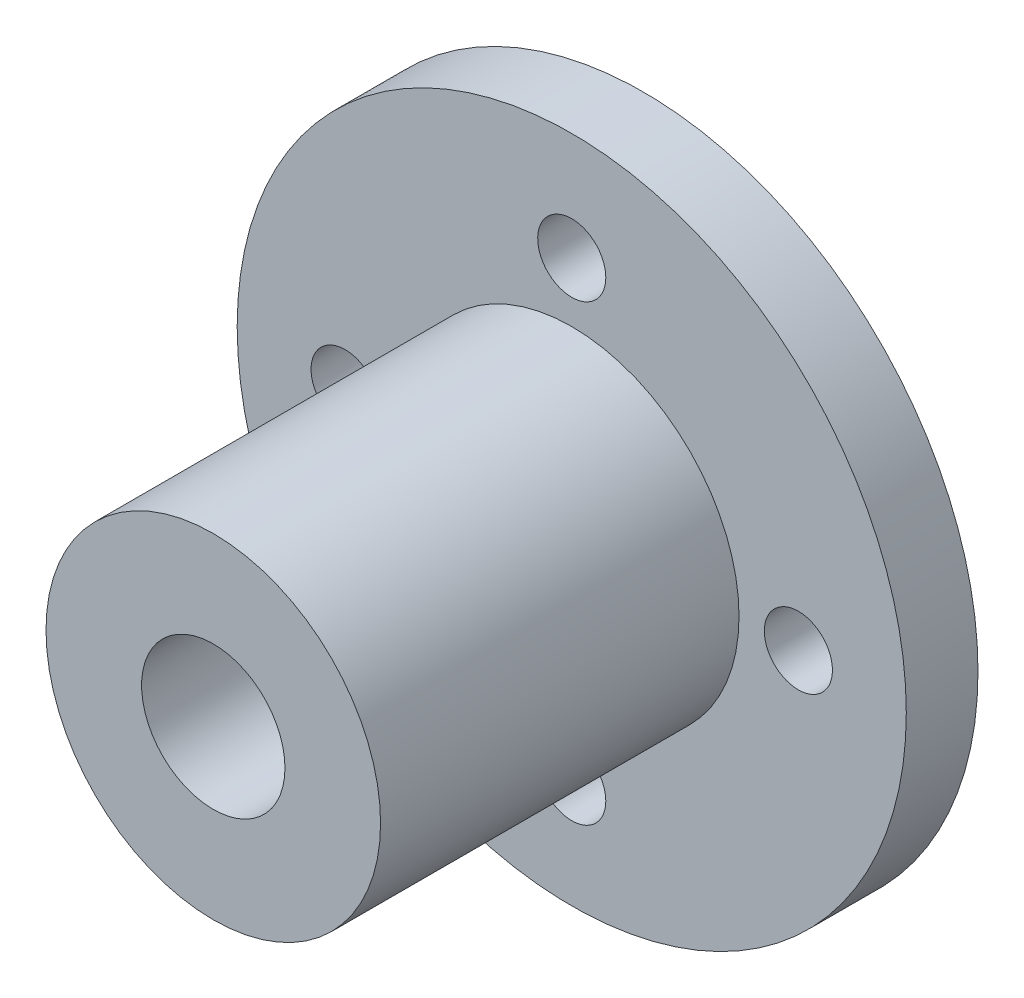
from build123d import *

# Parameters (mm, degrees)
IZIM1_R                     = 14
Y_KSEKLIK_EKSTR_ZYON1_DEPTH = 3
IZIM2_R                     = 7
Y_KSEKLIK_EKSTR_ZYON2_DEPTH = 15
IZIM3_R                     = 3
KES_EKSTR_ZYON1_DEPTH       = 18
IZIM4_R                     = 1.425
KES_EKSTR_ZYON2_DEPTH       = 18
DAIRESEL_KAPLAMA1_COUNT     = 4


with BuildPart() as part:
    # Çizim1 → Yükseklik-Ekstrüzyon1 (new body)
    with BuildSketch(Plane.XY):
        with Locations((-21.416051853, 15.917841079)):
            Circle(IZIM1_R)
    extrude(amount=Y_KSEKLIK_EKSTR_ZYON1_DEPTH)

    # Çizim2 → Yükseklik-Ekstrüzyon2 (add)
    with BuildSketch(Plane.XY.offset(3)):
        with Locations((-21.416051853, 15.917841079)):
            Circle(IZIM2_R)
    extrude(amount=Y_KSEKLIK_EKSTR_ZYON2_DEPTH)

    # Çizim3 → Kes-Ekstrüzyon1 (cut)
    with BuildSketch(Plane.XY.offset(18)):
        with Locations((-21.416051853, 15.917841079)):
            Circle(IZIM3_R)
    extrude(amount=-KES_EKSTR_ZYON1_DEPTH, mode=Mode.SUBTRACT)

    # Çizim4 → Kes-Ekstrüzyon2 (cut)
    with BuildSketch(Plane.XY.offset(3)):
        with Locations((-30.900018725, 15.917841079)):
            Circle(IZIM4_R)
    kes_ekstr_zyon2 = extrude(amount=-KES_EKSTR_ZYON2_DEPTH, mode=Mode.SUBTRACT)

    # Dairesel Kaplama1: Kes-Ekstrüzyon2 ×4 about axis
    dairesel_kaplama1_axis = Axis((-21.416051853, 15.917841079, 0), (0, 0, 1))
    for i in range(1, DAIRESEL_KAPLAMA1_COUNT):
        add(kes_ekstr_zyon2.rotate(dairesel_kaplama1_axis, i * 360 / DAIRESEL_KAPLAMA1_COUNT), mode=Mode.SUBTRACT)


solid = part.part
